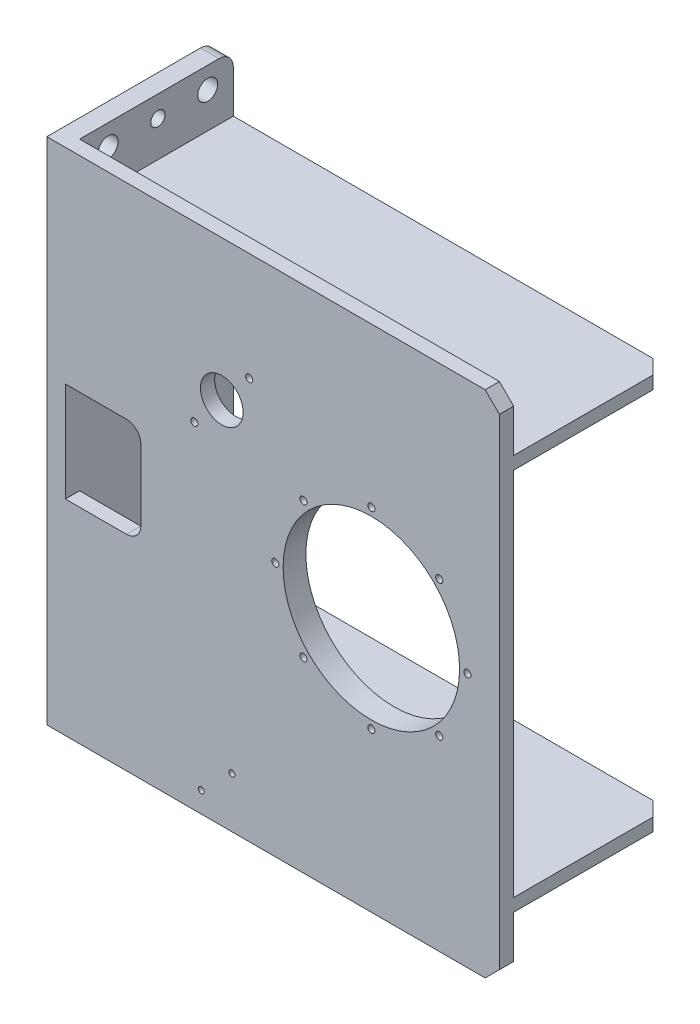
from build123d import *

# Parameters (mm, degrees)
EXTRUDE_1_DEPTH     = 10
EXTRUDE_2_DEPTH     = 13
EXTRUDE_3_DEPTH     = 9
EXTRUDE_4_DEPTH     = 9
SKETCH_7_R          = 74.5
SKETCH_7_R_2        = 62
EXTRUDE_5_DEPTH     = 16
SKETCH_8_R          = 62
CUT_EXTRUDE_1_DEPTH = 10
SKETCH_9_R          = 15
CUT_EXTRUDE_2_DEPTH = 10
SKETCH_10_R         = 2.5
CUT_EXTRUDE_3_DEPTH = 10
SKETCH_11_R         = 2.1
CUT_EXTRUDE_4_DEPTH = 10
SKETCH_12_R         = 2.5
CUT_EXTRUDE_5_DEPTH = 16
SKETCH_14_R         = 7
CUT_EXTRUDE_7_DEPTH = 13
SKETCH_16_R         = 5
CUT_EXTRUDE_9_DEPTH = 13


with BuildPart() as part:
    # ｽｹｯﾁ1 → ﾎﾞｽ - 押し出し1 (new body)
    with BuildSketch(Plane.XY):
        with BuildLine():
            Line((13, 0), (308, 0))
            Line((308, 0), (318, 10))
            Line((318, 10), (318, 348))
            Line((318, 348), (308, 358))
            Line((308, 358), (13, 358))
            Line((13, 358), (13, 214))
            Line((13, 214), (56, 214))
            ThreePointArc((56, 214), (63.071067812, 211.071067812), (66, 204))
            Line((66, 204), (66, 154))
            ThreePointArc((66, 154), (63.071067812, 146.928932188), (56, 144))
            Line((56, 144), (13, 144))
            Line((13, 144), (13, 0))
        make_face()
    extrude(amount=-EXTRUDE_1_DEPTH)

    # ｽｹｯﾁ2 → ﾎﾞｽ - 押し出し2 (add)
    with BuildSketch(Plane(origin=(0, 0, 0), x_dir=(0, 0, -1), z_dir=(1, 0, 0))):
        with BuildLine():
            Line((0, 0), (108, 0))
            ThreePointArc((108, 0), (115.071067812, 2.928932188), (118, 10))
            Line((118, 10), (118, 348))
            ThreePointArc((118, 348), (115.071067812, 355.071067812), (108, 358))
            Line((108, 358), (0, 358))
            Line((0, 358), (0, 0))
        make_face()
    extrude(amount=EXTRUDE_2_DEPTH)

    # ｽｹｯﾁ4 → ﾎﾞｽ - 押し出し3 (add)
    with BuildSketch(Plane(origin=(0, 40, 0), x_dir=(1, 0, 0), z_dir=(0, 1, 0))):
        Polygon((13, 10), (318, 10), (318, 108), (308, 118), (13, 118), align=None)
    extrude(amount=EXTRUDE_3_DEPTH)

    # ｽｹｯﾁ6 → ﾎﾞｽ - 押し出し4 (add)
    with BuildSketch(Plane(origin=(0, 309, 0), x_dir=(1, 0, 0), z_dir=(0, 1, 0))):
        Polygon((13, 10), (318, 10), (318, 108), (308, 118), (13, 118), align=None)
    extrude(amount=EXTRUDE_4_DEPTH)

    # ｽｹｯﾁ7 → ﾎﾞｽ - 押し出し5 (add)
    with BuildSketch(Plane.XY):
        with Locations((228, 179)):
            Circle(SKETCH_7_R)
        with Locations((228, 179)):
            Circle(SKETCH_7_R_2, mode=Mode.SUBTRACT)
    extrude(amount=-EXTRUDE_5_DEPTH)

    # ｽｹｯﾁ8 → ｶｯﾄ - 押し出し1 (cut)
    with BuildSketch(Plane.XY):
        with Locations((228, 179)):
            Circle(SKETCH_8_R)
    extrude(amount=-CUT_EXTRUDE_1_DEPTH, mode=Mode.SUBTRACT)

    # ｽｹｯﾁ9 → ｶｯﾄ - 押し出し2 (cut)
    with BuildSketch(Plane.XY):
        with Locations((122.891, 259.0915)):
            Circle(SKETCH_9_R)
    extrude(amount=-CUT_EXTRUDE_2_DEPTH, mode=Mode.SUBTRACT)

    # ｽｹｯﾁ10 → ｶｯﾄ - 押し出し3 (cut)
    with BuildSketch(Plane.XY):
        with Locations((103.6074, 236.1102)):
            Circle(SKETCH_10_R)
        with Locations((142.1746, 282.0728)):
            Circle(SKETCH_10_R)
    extrude(amount=-CUT_EXTRUDE_3_DEPTH, mode=Mode.SUBTRACT)

    # ｽｹｯﾁ11 → ｶｯﾄ - 押し出し4 (cut)
    with BuildSketch(Plane.XY):
        with Locations((108.5, 14.5)):
            Circle(SKETCH_11_R)
        with Locations((130, 35.5)):
            Circle(SKETCH_11_R)
    extrude(amount=-CUT_EXTRUDE_4_DEPTH, mode=Mode.SUBTRACT)

    # ｽｹｯﾁ12 → ｶｯﾄ - 押し出し5 (cut)
    with BuildSketch(Plane.XY):
        with Locations((295.5, 179)):
            Circle(SKETCH_12_R)
        with Locations((275.7297, 226.7297)):
            Circle(SKETCH_12_R)
        with Locations((228, 246.5)):
            Circle(SKETCH_12_R)
        with Locations((180.2703, 226.7297)):
            Circle(SKETCH_12_R)
        with Locations((160.5, 179)):
            Circle(SKETCH_12_R)
        with Locations((180.2703, 131.2703)):
            Circle(SKETCH_12_R)
        with Locations((228, 111.5)):
            Circle(SKETCH_12_R)
        with Locations((275.7297, 131.2703)):
            Circle(SKETCH_12_R)
    extrude(amount=-CUT_EXTRUDE_5_DEPTH, mode=Mode.SUBTRACT)

    # ｽｹｯﾁ14 → ｶｯﾄ - 押し出し7 (cut)
    with BuildSketch(Plane(origin=(0, 0, 0), x_dir=(0, 0, -1), z_dir=(1, 0, 0))):
        with Locations((30, 15)):
            Circle(SKETCH_14_R)
        with Locations((100, 15)):
            Circle(SKETCH_14_R)
        with Locations((30, 343)):
            Circle(SKETCH_14_R)
        with Locations((100, 343)):
            Circle(SKETCH_14_R)
        with Locations((100, 123)):
            Circle(SKETCH_14_R)
        with Locations((100, 235)):
            Circle(SKETCH_14_R)
    extrude(amount=CUT_EXTRUDE_7_DEPTH, mode=Mode.SUBTRACT)

    # ｽｹｯﾁ16 → ｶｯﾄ - 押し出し9 (cut)
    with BuildSketch(Plane(origin=(0, 0, 0), x_dir=(0, 0, -1), z_dir=(1, 0, 0))):
        with Locations((65, 15)):
            Circle(SKETCH_16_R)
        with Locations((65, 343)):
            Circle(SKETCH_16_R)
    extrude(amount=CUT_EXTRUDE_9_DEPTH, mode=Mode.SUBTRACT)


solid = part.part
